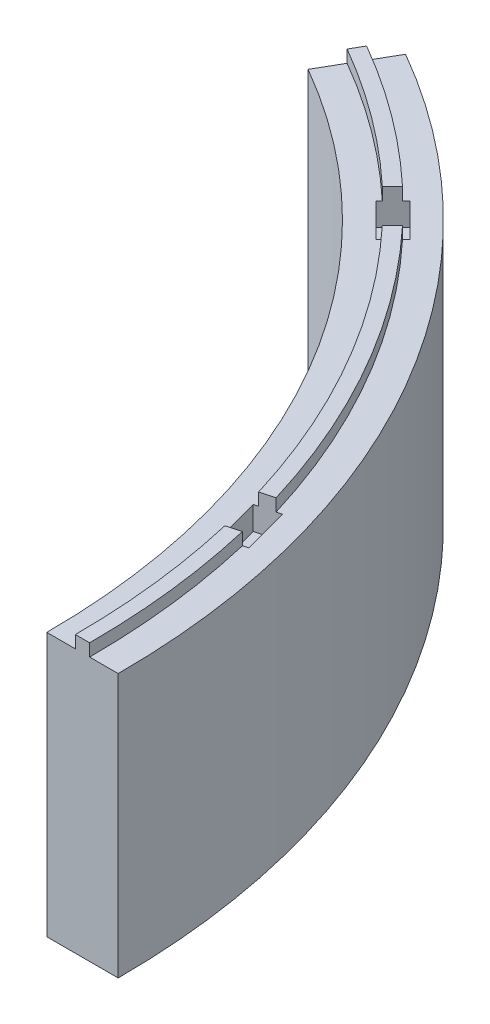
from build123d import *

# Parameters (mm, degrees)
AUFSATZ_LINEAR_AUSTRAGEN1_DEPTH = 55.4
AUFSATZ_LINEAR_AUSTRAGEN2_DEPTH = 2.6
SCHNITT_LINEAR_AUSTRAGEN1_DEPTH = 7.5
SKIZZE4_R                       = 2.2
SCHNITT_LINEAR_AUSTRAGEN2_DEPTH = 10


with BuildPart() as part:
    # Skizze1 → Aufsatz-Linear austragen1 (new body)
    with BuildSketch(Plane(origin=(0, 0, 0), x_dir=(1, 0, 0), z_dir=(0, 1, 0))):
        with BuildLine():
            Line((75, 129.903810568), (82.5, 142.894191624))
            ThreePointArc((82.5, 142.894191624), (142.894191624, 82.5), (165, 0))
            Line((165, 0), (150, 0))
            ThreePointArc((150, 0), (129.903810568, 75), (75, 129.903810568))
        make_face()
    extrude(amount=AUFSATZ_LINEAR_AUSTRAGEN1_DEPTH)

    # Skizze2 → Aufsatz-Linear austragen2 (add)
    with BuildSketch(Plane(origin=(0, 55.4, 0), x_dir=(1, 0, 0), z_dir=(0, 1, 0))):
        with BuildLine():
            Line((78, 135.09996299), (79.5, 137.698039202))
            ThreePointArc((79.5, 137.698039202), (137.698039202, 79.5), (159, 0))
            Line((159, 0), (156, 0))
            ThreePointArc((156, 0), (135.09996299, 78), (78, 135.09996299))
        make_face()
    extrude(amount=AUFSATZ_LINEAR_AUSTRAGEN2_DEPTH)

    # Skizze3 → Schnitt-Linear austragen1 (cut)
    with BuildSketch(Plane(origin=(0, 58, 0), x_dir=(1, 0, 0), z_dir=(0, 1, 0))):
        Polygon((148.424407849, 44.946581122), (153.254036981, 46.240676348), (155.842227432, 36.581418085), (151.0125983, 35.287322859), align=None)
        Polygon((106.066017178, 113.13708499), (109.601551084, 116.672618896), (116.672618896, 109.601551084), (113.13708499, 106.066017178), align=None)
    extrude(amount=-SCHNITT_LINEAR_AUSTRAGEN1_DEPTH, mode=Mode.SUBTRACT)

    # Skizze4 → Schnitt-Linear austragen2 (cut)
    with BuildSketch(Plane.XZ):
        with Locations(Location((111.369318037, -111.369318037, 0), (0, 0, 270))):
            Circle(SKIZZE4_R)
        with Locations(Location((152.133317641, -40.763999604, 0), (0, 0, 270))):
            Circle(SKIZZE4_R)
    extrude(amount=-SCHNITT_LINEAR_AUSTRAGEN2_DEPTH, mode=Mode.SUBTRACT)


solid = part.part
